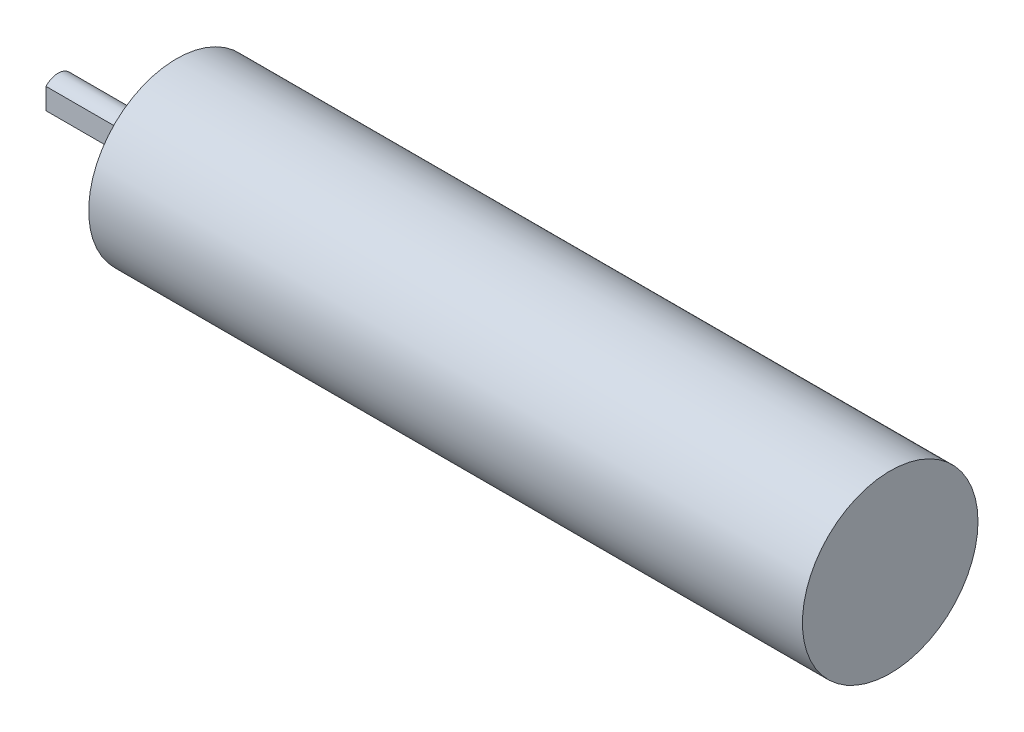
from build123d import *

# Parameters (mm, degrees)
SKETCH1_W           = 52.6
SKETCH1_H           = 11
SKETCH2_R           = 5
BOSS_EXTRUDE1_DEPTH = 1.35
SKETCH3_R           = 3.5
BOSS_EXTRUDE2_DEPTH = 1.8
SKETCH4_R           = 2
BOSS_EXTRUDE3_DEPTH = 11.7
CUT_EXTRUDE1_REACH  = 71.221
HOLE1_D             = 1.95
HOLE1_DEPTH         = 6.5
HOLE2_D             = 1.95
HOLE2_DEPTH         = 6.5
HOLE3_D             = 1.95
HOLE3_DEPTH         = 6.5
HOLE4_D             = 7
HOLE4_DEPTH         = 6.4
HOLE5_D             = 2.1
HOLE5_DEPTH         = 3
HOLE6_D             = 2.1
HOLE6_DEPTH         = 3
HOLE7_D             = 2.1
HOLE7_DEPTH         = 3
SKETCH25_R          = 11
BOSS_EXTRUDE4_DEPTH = 36.83


with BuildPart() as part:
    # Sketch1 → Revolve1 (revolve)
    with BuildSketch(Plane.XY, mode=Mode.PRIVATE) as revolve1_sk:
        with Locations((26.3, 5.5)):
            Rectangle(SKETCH1_W, SKETCH1_H)
    revolve(revolve1_sk.sketch.rotate(Axis((0, 0, 0), (1, 0, 0)), 270), axis=Axis((0, 0, 0), (1, 0, 0)))

    # Sketch2 → Boss-Extrude1 (add)
    with BuildSketch(Plane.ZY):
        with Locations(Location((0, 0, 0), (0, 0, 180))):
            Circle(SKETCH2_R)
    extrude(amount=BOSS_EXTRUDE1_DEPTH)

    # Sketch3 → Boss-Extrude2 (add)
    with BuildSketch(Plane.ZY.offset(1.35)):
        Circle(SKETCH3_R)
    extrude(amount=BOSS_EXTRUDE2_DEPTH)

    # Sketch4 → Boss-Extrude3 (add)
    with BuildSketch(Plane.ZY.offset(3.15)):
        Circle(SKETCH4_R)
    extrude(amount=BOSS_EXTRUDE3_DEPTH)

    # Cut-Extrude1: up to this plane
    cut_extrude1_end = Plane(origin=(-3.675, 0, 3.675), z_dir=(0.707106781186547, 0, -0.707106781186548))
    # Sketch6 → Cut-Extrude1 (cut, up to the surface)
    with BuildSketch(Plane.ZY.offset(14.85), mode=Mode.PRIVATE) as cut_extrude1_sk1:
        with BuildLine():
            Line((1.5, 1.322875656), (1.5, -1.322875656))
            ThreePointArc((1.5, -1.322875656), (2, 0), (1.5, 1.322875656))
        make_face()
    cut_extrude1_tool1 = split(extrude(cut_extrude1_sk1.sketch, amount=-CUT_EXTRUDE1_REACH, mode=Mode.PRIVATE), bisect_by=cut_extrude1_end, keep=Keep.BOTH, mode=Mode.PRIVATE)
    add(cut_extrude1_tool1.solids().sort_by_distance((-14.85, 0, 1.702311))[0], mode=Mode.SUBTRACT)

    # Hole1
    with Locations(Plane.ZY):
        with Locations((7, 0)):
            Hole(HOLE1_D / 2, depth=HOLE1_DEPTH)

    # Hole2
    with Locations(Plane.ZY):
        with Locations((-3.5, -6.062177826)):
            Hole(HOLE2_D / 2, depth=HOLE2_DEPTH)

    # Hole3
    with Locations(Plane.ZY):
        with Locations((-3.5, 6.062177826)):
            Hole(HOLE3_D / 2, depth=HOLE3_DEPTH)

    # Hole4
    with Locations(Plane(origin=(52.6, 0, 0), x_dir=(0, 0, -1), z_dir=(1, 0, 0))):
        with Locations((0, 0)):
            Hole(HOLE4_D / 2, depth=HOLE4_DEPTH)

    # Hole5
    with Locations(Plane(origin=(52.6, 0, 0), x_dir=(0, 0, -1), z_dir=(1, 0, 0))):
        with Locations((-8.5, 0)):
            Hole(HOLE5_D / 2, depth=HOLE5_DEPTH)

    # Hole6
    with Locations(Plane(origin=(52.6, 0, 0), x_dir=(0, 0, -1), z_dir=(1, 0, 0))):
        with Locations((4.25, -7.361215932)):
            Hole(HOLE6_D / 2, depth=HOLE6_DEPTH)

    # Hole7
    with Locations(Plane(origin=(52.6, 0, 0), x_dir=(0, 0, -1), z_dir=(1, 0, 0))):
        with Locations((4.25, 7.361215932)):
            Hole(HOLE7_D / 2, depth=HOLE7_DEPTH)

    # Sketch25 → Boss-Extrude4 (add)
    with BuildSketch(Plane(origin=(52.6, 0, 0), x_dir=(0, 0, -1), z_dir=(1, 0, 0))):
        Circle(SKETCH25_R)
    extrude(amount=BOSS_EXTRUDE4_DEPTH)


solid = part.part
